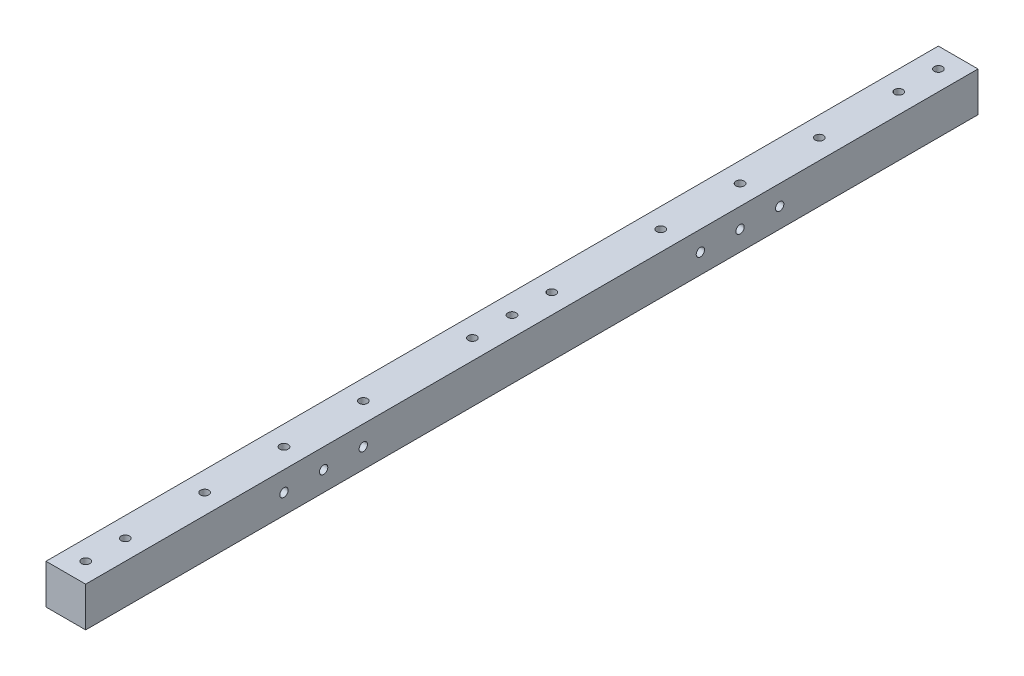
from build123d import *

# Parameters (mm, degrees)
SKETCH_1_W          = 20
SKETCH_1_H          = 20
EXTRUDE_1_DEPTH     = 450
SKETCH_2_R          = 2.1
CUT_EXTRUDE_1_DEPTH = 451.555213043
SKETCH_3_R          = 2.1
CUT_EXTRUDE_2_DEPTH = 451.555213043
SKETCH_4_R          = 2.1
CUT_EXTRUDE_3_DEPTH = 451.555213043


with BuildPart() as part:
    # 草图1 → 凸台-拉伸1 (new body)
    with BuildSketch(Plane.XY):
        Rectangle(SKETCH_1_W, SKETCH_1_H)
    extrude(amount=EXTRUDE_1_DEPTH)

    # 草图2 → 切除-拉伸1 (cut, through all)
    with BuildSketch(Plane(origin=(10, 0, 0), x_dir=(0, 0, -1), z_dir=(1, 0, 0))):
        with Locations((-100, 0)):
            Circle(SKETCH_2_R)
        with Locations((-120, 0)):
            Circle(SKETCH_2_R)
        with Locations((-140, 0)):
            Circle(SKETCH_2_R)
        with Locations(Location((-350, 0, 0), (0, 0, 180))):
            Circle(SKETCH_2_R)
        with Locations(Location((-330, 0, 0), (0, 0, 180))):
            Circle(SKETCH_2_R)
        with Locations(Location((-310, 0, 0), (0, 0, 180))):
            Circle(SKETCH_2_R)
    extrude(amount=-CUT_EXTRUDE_1_DEPTH, mode=Mode.SUBTRACT)

    # 草图3 → 切除-拉伸2 (cut, through all)
    with BuildSketch(Plane(origin=(0, 10, 0), x_dir=(1, 0, 0), z_dir=(0, 1, 0))):
        with Locations(Location((0, -245, 0), (0, 0, 270))):
            Circle(SKETCH_3_R)
        with Locations(Location((0, -225, 0), (0, 0, 270))):
            Circle(SKETCH_3_R)
        with Locations(Location((0, -205, 0), (0, 0, 270))):
            Circle(SKETCH_3_R)
    extrude(amount=-CUT_EXTRUDE_2_DEPTH, mode=Mode.SUBTRACT)

    # 草图4 → 切除-拉伸3 (cut, through all)
    with BuildSketch(Plane(origin=(0, 10, 0), x_dir=(1, 0, 0), z_dir=(0, 1, 0))):
        with Locations(Location((0, -10, 0), (0, 0, 270))):
            Circle(SKETCH_4_R)
        with Locations(Location((0, -30, 0), (0, 0, 270))):
            Circle(SKETCH_4_R)
        with Locations(Location((0, -440, 0), (0, 0, 90))):
            Circle(SKETCH_4_R)
        with Locations(Location((0, -420, 0), (0, 0, 90))):
            Circle(SKETCH_4_R)
        with Locations(Location((0, -70, 0), (0, 0, 270))):
            Circle(SKETCH_4_R)
        with Locations(Location((0, -110, 0), (0, 0, 270))):
            Circle(SKETCH_4_R)
        with Locations(Location((0, -150, 0), (0, 0, 270))):
            Circle(SKETCH_4_R)
        with Locations(Location((0, -380, 0), (0, 0, 90))):
            Circle(SKETCH_4_R)
        with Locations(Location((0, -340, 0), (0, 0, 90))):
            Circle(SKETCH_4_R)
        with Locations(Location((0, -300, 0), (0, 0, 90))):
            Circle(SKETCH_4_R)
    extrude(amount=-CUT_EXTRUDE_3_DEPTH, mode=Mode.SUBTRACT)


solid = part.part
